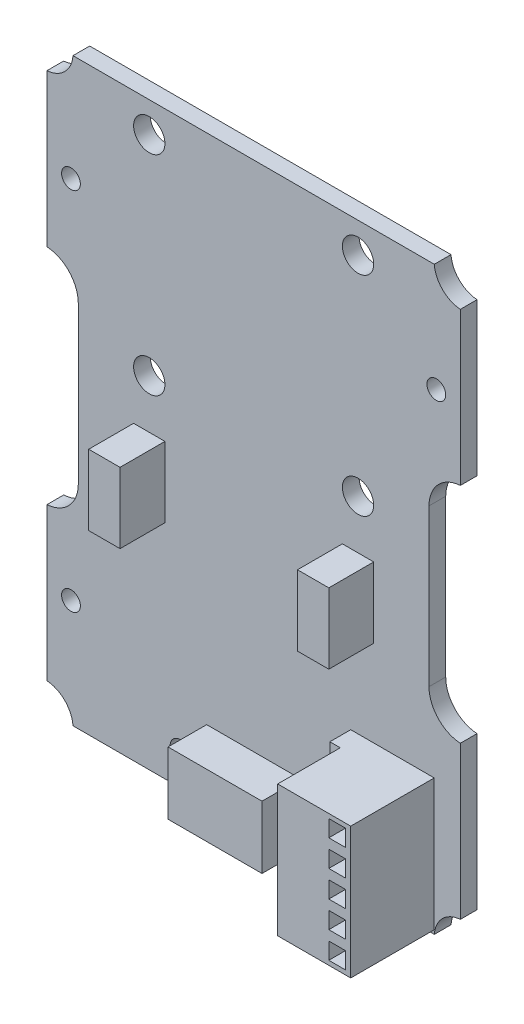
from build123d import *

# Parameters (mm, degrees)
EXTRUDE_1_DEPTH     = 1.6
SKETCH_2_3_R        = 0.9
SKETCH_2_3_W        = 1.6
SKETCH_2_3_H        = 1.6
CUT_EXTRUDE_4_DEPTH = 35.167821119
SKETCH_3_W          = 9
SKETCH_3_H          = 6
EXTRUDE_2_DEPTH     = 3.7
SKETCH_4_R          = 1.5
CUT_EXTRUDE_5_DEPTH = 35.33030731
SKETCH_8_W          = 8
SKETCH_8_H          = 12.6
SKETCH_8_W_2        = 1.6
SKETCH_8_H_2        = 1.6
EXTRUDE_7_DEPTH     = 8
SKETCH_9_W          = 3
SKETCH_9_H          = 6.75
EXTRUDE_9_DEPTH     = 4.3
SKETCH_10_R         = 1
CUT_EXTRUDE_6_DEPTH = 36.05538475
SKETCH_11_W         = 1
SKETCH_11_H         = 6
CUT_EXTRUDE_7_DEPTH = 12.6


with BuildPart() as part:
    # 草图2 → 凸台-拉伸1 (new body)
    with BuildSketch(Plane.XY):
        with BuildLine():
            Line((19.8, 10.693743885), (19.8, 25.307417596))
            ThreePointArc((19.8, 25.307417596), (18.090811691, 26.090811691), (17.307417596, 27.8))
            Line((17.307417596, 27.8), (-17.307417596, 27.8))
            ThreePointArc((-17.307417596, 27.8), (-18.090811691, 26.090811691), (-19.8, 25.307417596))
            Line((-19.8, 25.307417596), (-19.8, 10.693743885))
            ThreePointArc((-19.8, 10.693743885), (-17.667619242, 9.69089023), (-16.8, 7.5))
            Line((-16.8, 7.5), (-16.8, -7.5))
            ThreePointArc((-16.8, -7.5), (-17.667619242, -9.69089023), (-19.8, -10.693743885))
            Line((-19.8, -10.693743885), (-19.8, -25.307417596))
            ThreePointArc((-19.8, -25.307417596), (-18.090811691, -26.090811691), (-17.307417596, -27.8))
            Line((-17.307417596, -27.8), (17.307417596, -27.8))
            ThreePointArc((17.307417596, -27.8), (18.090811691, -26.090811691), (19.8, -25.307417596))
            Line((19.8, -25.307417596), (19.8, -10.693743885))
            ThreePointArc((19.8, -10.693743885), (17.667619242, -9.69089023), (16.8, -7.5))
            Line((16.8, -7.5), (16.8, 7.5))
            ThreePointArc((16.8, 7.5), (17.667619242, 9.69089023), (19.8, 10.693743885))
        make_face()
    extrude(amount=EXTRUDE_1_DEPTH)

    # 草图2<3> → 切除-拉伸4 (cut, through all)
    with BuildSketch(Plane.XY):
        with Locations((17.5, 17.5)):
            Circle(SKETCH_2_3_R)
        with Locations((-17.5, 17.5)):
            Circle(SKETCH_2_3_R)
        with Locations((-17.5, -17.5)):
            Circle(SKETCH_2_3_R)
        with Locations((16, -16.04)):
            Rectangle(SKETCH_2_3_W, SKETCH_2_3_H)
        with Locations((16, -18.58)):
            Rectangle(SKETCH_2_3_W, SKETCH_2_3_H)
        with Locations((16, -21.12)):
            Rectangle(SKETCH_2_3_W, SKETCH_2_3_H)
        with Locations((16, -23.66)):
            Rectangle(SKETCH_2_3_W, SKETCH_2_3_H)
        with Locations((16, -26.2)):
            Rectangle(SKETCH_2_3_W, SKETCH_2_3_H)
    extrude(amount=CUT_EXTRUDE_4_DEPTH, mode=Mode.SUBTRACT)

    # 草图3 → 凸台-拉伸2 (add)
    with BuildSketch(Plane.XY.offset(1.6)):
        with Locations((0, -24.3)):
            Rectangle(SKETCH_3_W, SKETCH_3_H)
    extrude(amount=EXTRUDE_2_DEPTH)

    # 草图4 → 切除-拉伸5 (cut, through all)
    with BuildSketch(Plane.XY.offset(1.6)):
        with Locations((-10, 24.9)):
            Circle(SKETCH_4_R)
        with Locations((10, 24.9)):
            Circle(SKETCH_4_R)
        with Locations((-10, 4.9)):
            Circle(SKETCH_4_R)
        with Locations((10, 4.9)):
            Circle(SKETCH_4_R)
    extrude(amount=-CUT_EXTRUDE_5_DEPTH, mode=Mode.SUBTRACT)

    # 草图8 → 凸台-拉伸7 (add)
    with BuildSketch(Plane.XY.offset(1.6)):
        with Locations((13.3, -21.12)):
            Rectangle(SKETCH_8_W, SKETCH_8_H)
        with Locations((16, -26.2)):
            Rectangle(SKETCH_8_W_2, SKETCH_8_H_2, mode=Mode.SUBTRACT)
        with Locations((16, -23.66)):
            Rectangle(SKETCH_8_W_2, SKETCH_8_H_2, mode=Mode.SUBTRACT)
        with Locations((16, -21.12)):
            Rectangle(SKETCH_8_W_2, SKETCH_8_H_2, mode=Mode.SUBTRACT)
        with Locations((16, -18.58)):
            Rectangle(SKETCH_8_W_2, SKETCH_8_H_2, mode=Mode.SUBTRACT)
        with Locations((16, -16.04)):
            Rectangle(SKETCH_8_W_2, SKETCH_8_H_2, mode=Mode.SUBTRACT)
    extrude(amount=EXTRUDE_7_DEPTH)

    # 草图9 → 凸台-拉伸9 (add)
    with BuildSketch(Plane.XY.offset(1.6)):
        with Locations((-10, -3.175)):
            Rectangle(SKETCH_9_W, SKETCH_9_H)
        with Locations((10, -3.175)):
            Rectangle(SKETCH_9_W, SKETCH_9_H)
    extrude(amount=EXTRUDE_9_DEPTH)

    # 草图10 → 切除-拉伸6 (cut, through all)
    with BuildSketch(Plane.XY.offset(1.6)):
        with Locations((-7, -24.8)):
            Circle(SKETCH_10_R)
        with Locations(Location((7, -24.8, 0), (0, 0, 180))):
            Circle(SKETCH_10_R)
    extrude(amount=-CUT_EXTRUDE_6_DEPTH, mode=Mode.SUBTRACT)

    # 草图11 → 切除-拉伸7 (cut)
    with BuildSketch(Plane.XZ.offset(27.42)):
        with Locations((9.8, 6.6)):
            Rectangle(SKETCH_11_W, SKETCH_11_H)
    extrude(amount=-CUT_EXTRUDE_7_DEPTH, mode=Mode.SUBTRACT)


solid = part.part
